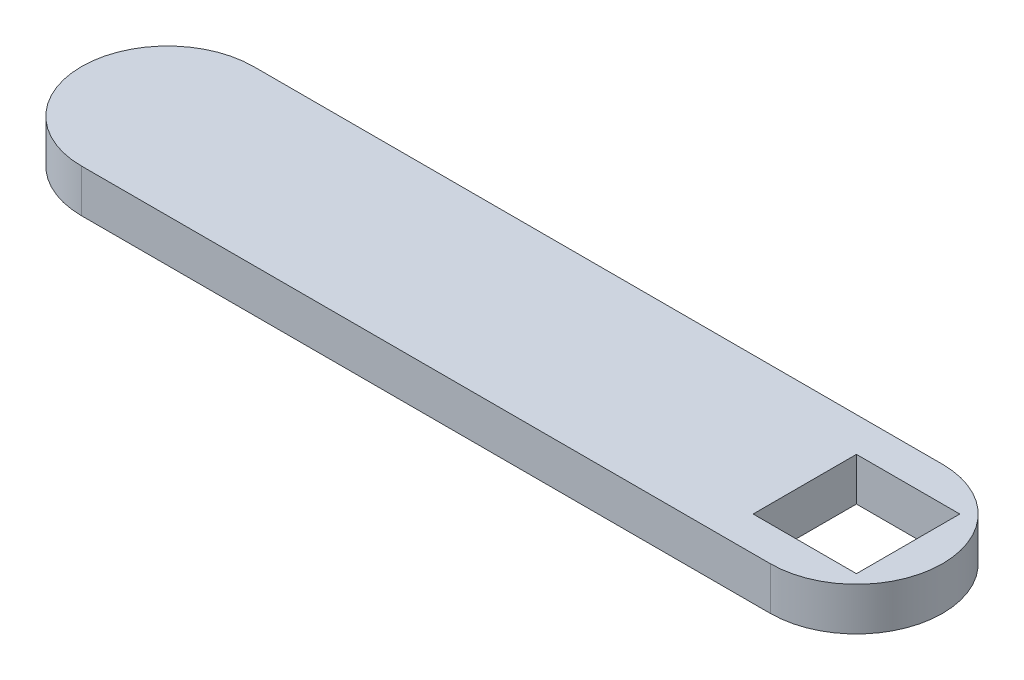
from build123d import *

# Parameters (mm, degrees)
EXTRUDE_1_DEPTH     = 25
SKETCH_3_W          = 60
SKETCH_3_H          = 60
CUT_EXTRUDE_1_DEPTH = 25


with BuildPart() as part:
    # 草图1 → 凸台-拉伸1 (new body)
    with BuildSketch(Plane(origin=(0, 0, 0), x_dir=(1, 0, 0), z_dir=(0, 1, 0))):
        with BuildLine():
            Line((-200, 50), (200, 50))
            ThreePointArc((200, 50), (250, 0), (200, -50))
            Line((200, -50), (-200, -50))
            ThreePointArc((-200, -50), (-250, 0), (-200, 50))
        make_face()
    extrude(amount=EXTRUDE_1_DEPTH)

    # 草图3 → 切除-拉伸1 (cut)
    with BuildSketch(Plane.XZ):
        with Locations((200, 0)):
            Rectangle(SKETCH_3_W, SKETCH_3_H)
    extrude(amount=-CUT_EXTRUDE_1_DEPTH, mode=Mode.SUBTRACT)


solid = part.part
